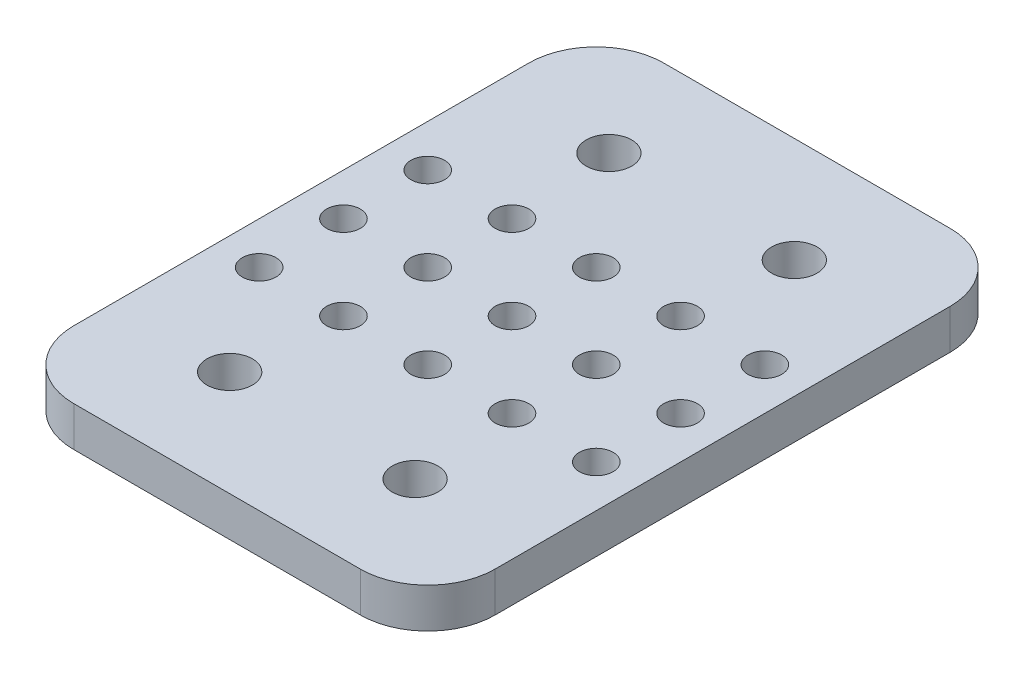
from build123d import *

# Parameters (mm, degrees)
SKETCH1_W           = 63.5
SKETCH1_H           = 88.9
SKETCH1_R           = 3.429
BOSS_EXTRUDE1_DEPTH = 6
FILLET1_R           = 10.16
SKETCH2_R           = 2.54
CUT_EXTRUDE1_DEPTH  = 110.414167273


with BuildPart() as part:
    # Sketch1 → Boss-Extrude1 (new body)
    with BuildSketch(Plane(origin=(0, 0, 0), x_dir=(1, 0, 0), z_dir=(0, 1, 0))):
        with Locations((31.75, 44.45)):
            Rectangle(SKETCH1_W, SKETCH1_H)
        with Locations(Location((17.78, 73.025, 0), (0, 0, 270))):
            Circle(SKETCH1_R, mode=Mode.SUBTRACT)
        with Locations(Location((45.72, 15.875, 0), (0, 0, 270))):
            Circle(SKETCH1_R, mode=Mode.SUBTRACT)
        with Locations(Location((17.78, 15.875, 0), (0, 0, 90))):
            Circle(SKETCH1_R, mode=Mode.SUBTRACT)
        with Locations(Location((45.72, 73.025, 0), (0, 0, 90))):
            Circle(SKETCH1_R, mode=Mode.SUBTRACT)
    extrude(amount=BOSS_EXTRUDE1_DEPTH)

    # Fillet1
    fillet1_edges = [part.edges().sort_by_distance(p)[0] for p in [
        (0, 3, -88.9),
        (63.5, 3, -88.9),
        (63.5, 3, 0),
        (0, 3, 0),
    ]]
    fillet(fillet1_edges, radius=FILLET1_R)

    # Sketch2 → Cut-Extrude1 (cut, through all)
    with BuildSketch(Plane(origin=(0, 6, 0), x_dir=(1, 0, 0), z_dir=(0, 1, 0))):
        with Locations(Location((6.35, 31.75, 0), (0, 0, 270))):
            Circle(SKETCH2_R)
        with Locations(Location((6.35, 44.45, 0), (0, 0, 270))):
            Circle(SKETCH2_R)
        with Locations(Location((6.35, 57.15, 0), (0, 0, 270))):
            Circle(SKETCH2_R)
        with Locations(Location((19.05, 57.15, 0), (0, 0, 270))):
            Circle(SKETCH2_R)
        with Locations(Location((19.05, 44.45, 0), (0, 0, 270))):
            Circle(SKETCH2_R)
        with Locations(Location((19.05, 31.75, 0), (0, 0, 270))):
            Circle(SKETCH2_R)
        with Locations(Location((31.75, 31.75, 0), (0, 0, 270))):
            Circle(SKETCH2_R)
        with Locations(Location((31.75, 44.45, 0), (0, 0, 270))):
            Circle(SKETCH2_R)
        with Locations(Location((31.75, 57.15, 0), (0, 0, 270))):
            Circle(SKETCH2_R)
        with Locations(Location((44.45, 57.15, 0), (0, 0, 270))):
            Circle(SKETCH2_R)
        with Locations(Location((44.45, 44.45, 0), (0, 0, 270))):
            Circle(SKETCH2_R)
        with Locations(Location((57.15, 44.45, 0), (0, 0, 270))):
            Circle(SKETCH2_R)
        with Locations(Location((57.15, 31.75, 0), (0, 0, 270))):
            Circle(SKETCH2_R)
        with Locations(Location((44.45, 31.75, 0), (0, 0, 270))):
            Circle(SKETCH2_R)
        with Locations(Location((57.15, 57.15, 0), (0, 0, 270))):
            Circle(SKETCH2_R)
    extrude(amount=-CUT_EXTRUDE1_DEPTH, mode=Mode.SUBTRACT)


solid = part.part
